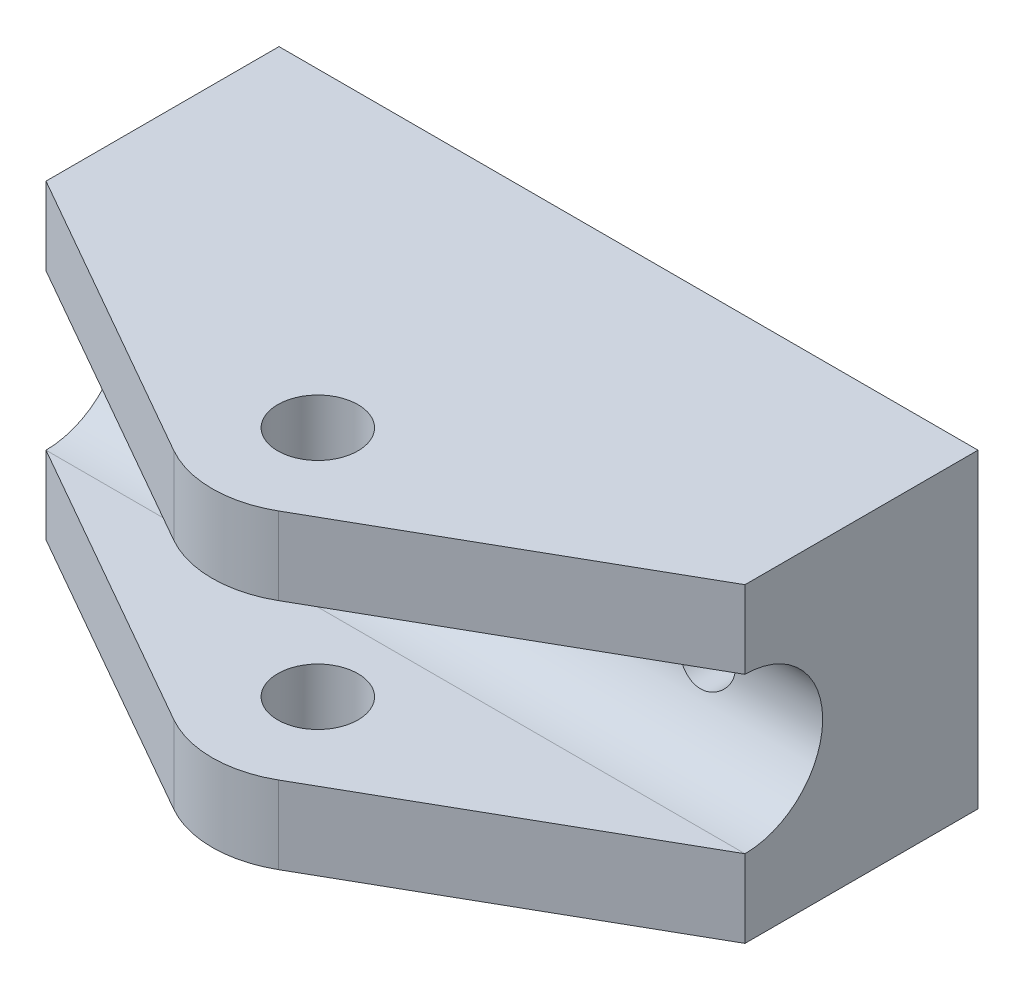
from build123d import *

# Parameters (mm, degrees)
SKETCH1_W           = 57.15
SKETCH1_H           = 25.4
SKETCH1_R           = 2.38125
BOSS_EXTRUDE1_DEPTH = 34.036
SKETCH2_R           = 3.281447176
CUT_EXTRUDE1_DEPTH  = 259.444021221
CUT_EXTRUDE2_DEPTH  = 263.565366711


with BuildPart() as part:
    # Sketch1 → Boss-Extrude1 (new body)
    with BuildSketch(Plane.XY):
        with Locations((226.355780427, 241.3)):
            Rectangle(SKETCH1_W, SKETCH1_H)
        with Locations((245.405780427, 241.3)):
            Circle(SKETCH1_R, mode=Mode.SUBTRACT)
        with Locations((207.305780427, 241.3)):
            Circle(SKETCH1_R, mode=Mode.SUBTRACT)
    extrude(amount=BOSS_EXTRUDE1_DEPTH)

    # Sketch2 → Cut-Extrude1 (cut, through all)
    with BuildSketch(Plane(origin=(0, 254, 0), x_dir=(1, 0, 0), z_dir=(0, 1, 0))):
        with BuildLine():
            Line((254.930780427, -34.036), (254.930780427, -19.05))
            Line((254.930780427, -19.05), (230.6329732, -32.902407479))
            ThreePointArc((230.6329732, -32.902407479), (228.568211783, -33.747792732), (226.355780427, -34.036))
            Line((226.355780427, -34.036), (254.930780427, -34.036))
        make_face()
        with BuildLine():
            Line((197.780780427, -34.036), (226.355780427, -34.036))
            ThreePointArc((226.355780427, -34.036), (224.143349071, -33.747792732), (222.078587654, -32.902407479))
            Line((222.078587654, -32.902407479), (197.780780427, -19.05))
            Line((197.780780427, -19.05), (197.780780427, -34.036))
        make_face()
        Polygon((226.681841891, -42.314106695), (197.780780427, -34.036), (254.930780427, -34.036), align=None)
        with Locations(Location((226.355780427, -25.4, 0), (0, 0, 270))):
            Circle(SKETCH2_R)
    extrude(amount=-CUT_EXTRUDE1_DEPTH, mode=Mode.SUBTRACT)

    # Sketch3 → Cut-Extrude2 (cut, through all)
    with BuildSketch(Plane.ZY.offset(-197.780780427)):
        with BuildLine():
            Line((19.05, 247.65), (49.022, 247.65))
            ThreePointArc((49.022, 247.65), (55.372, 241.3), (49.022, 234.95))
            Line((49.022, 234.95), (19.05, 234.95))
            ThreePointArc((19.05, 234.95), (12.7, 241.3), (19.05, 247.65))
        make_face()
    extrude(amount=-CUT_EXTRUDE2_DEPTH, mode=Mode.SUBTRACT)


solid = part.part
